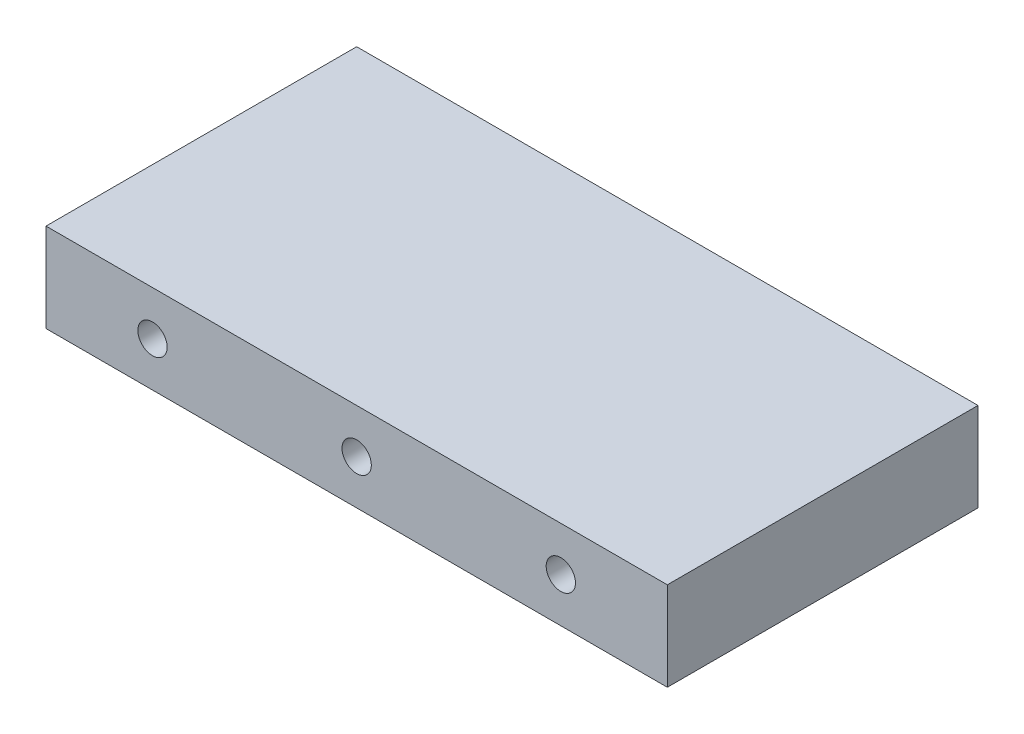
from build123d import *

# Parameters (mm, degrees)
SKETCH1_W           = 70
SKETCH1_H           = 35
BOSS_EXTRUDE1_DEPTH = 10
SKETCH2_R           = 1.65
CUT_EXTRUDE1_DEPTH  = 10


with BuildPart() as part:
    # Sketch1 → Boss-Extrude1 (new body)
    with BuildSketch(Plane(origin=(0, 0, 0), x_dir=(1, 0, 0), z_dir=(0, 1, 0))):
        Rectangle(SKETCH1_W, SKETCH1_H)
    extrude(amount=BOSS_EXTRUDE1_DEPTH)

    # Sketch2 → Cut-Extrude1 (cut)
    with BuildSketch(Plane.XY.offset(17.5)):
        with Locations((0, 5)):
            Circle(SKETCH2_R)
        with Locations((-23, 5)):
            Circle(SKETCH2_R)
        with Locations(Location((23, 5, 0), (0, 0, 180))):
            Circle(SKETCH2_R)
    cut_extrude1 = extrude(amount=-CUT_EXTRUDE1_DEPTH, mode=Mode.SUBTRACT)

    # Mirror1: Cut-Extrude1 across plane
    add(cut_extrude1.mirror(Plane.XY), mode=Mode.SUBTRACT)


solid = part.part
